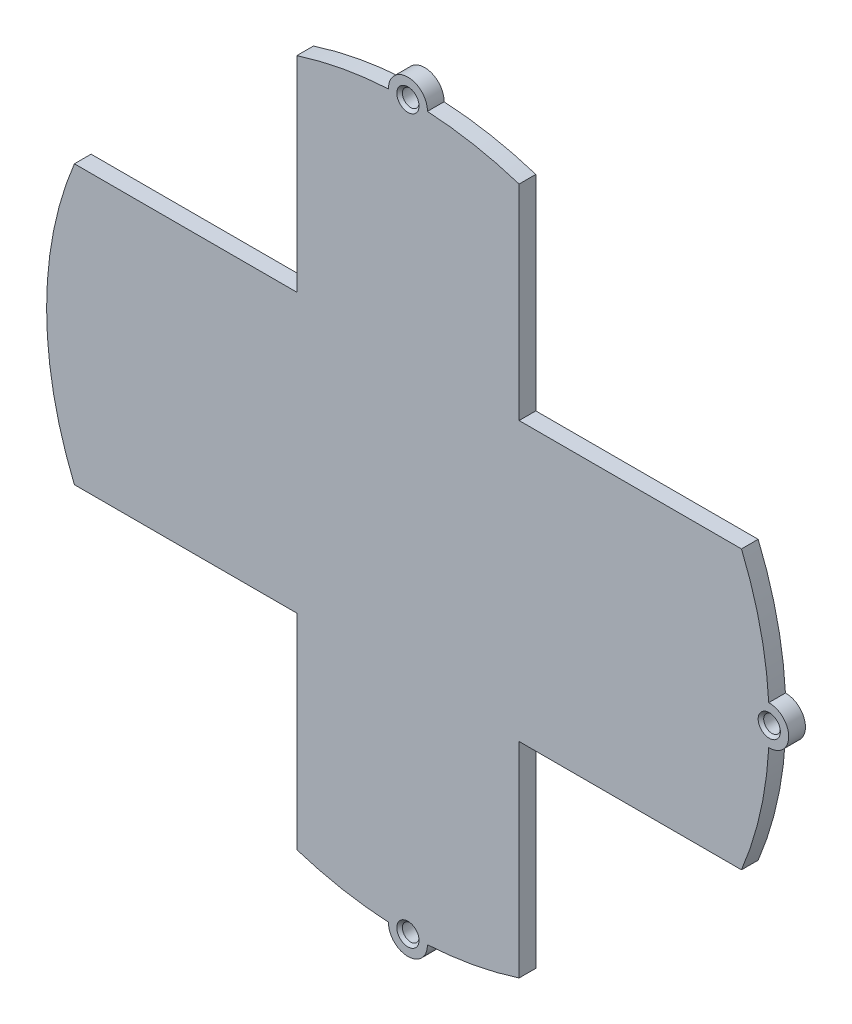
from build123d import *

# Parameters (mm, degrees)
EXTRUDE_1_DEPTH     = 3
SKETCH_2_R          = 3.5
EXTRUDE_2_DEPTH     = 3
SKETCH_3_R          = 1.5
CUT_EXTRUDE_1_DEPTH = 3
CHAMFER_1_SIZE      = 0.5


with BuildPart() as part:
    # 草图1 → 凸台-拉伸1 (new body)
    with BuildSketch(Plane.XY):
        with BuildLine():
            Line((20, -25), (20, -61.846584384))
            ThreePointArc((20, -61.846584384), (0, -65), (-20, -61.846584384))
            Line((-20, -61.846584384), (-20, -25))
            Line((-20, -25), (-60, -25))
            ThreePointArc((-60, -25), (-65, 0), (-60, 25))
            Line((-60, 25), (-20, 25))
            Line((-20, 25), (-20, 61.846584384))
            ThreePointArc((-20, 61.846584384), (0, 65), (20, 61.846584384))
            Line((20, 61.846584384), (20, 25))
            Line((20, 25), (60, 25))
            ThreePointArc((60, 25), (65, 0), (60, -25))
            Line((60, -25), (20, -25))
        make_face()
    extrude(amount=EXTRUDE_1_DEPTH)

    # 草图2 → 凸台-拉伸2 (add)
    with BuildSketch(Plane.XY.offset(3)):
        with Locations((65, 0)):
            Circle(SKETCH_2_R)
        with Locations((0, 65)):
            Circle(SKETCH_2_R)
        with Locations((0, -65)):
            Circle(SKETCH_2_R)
    extrude(amount=-EXTRUDE_2_DEPTH)

    # 草图3 → 切除-拉伸1 (cut)
    with BuildSketch(Plane.XY.offset(3)):
        with Locations((0, 65)):
            Circle(SKETCH_3_R)
        with Locations((65, 0)):
            Circle(SKETCH_3_R)
        with Locations((0, -65)):
            Circle(SKETCH_3_R)
    extrude(amount=-CUT_EXTRUDE_1_DEPTH, mode=Mode.SUBTRACT)

    # 倒角1
    chamfer_1_edges = [part.edges().sort_by_distance(p)[0] for p in [
        (-1.5, 65, 3),
        (63.5, 0, 3),
        (-1.5, -65, 3),
    ]]
    chamfer(chamfer_1_edges, length=CHAMFER_1_SIZE)


solid = part.part
